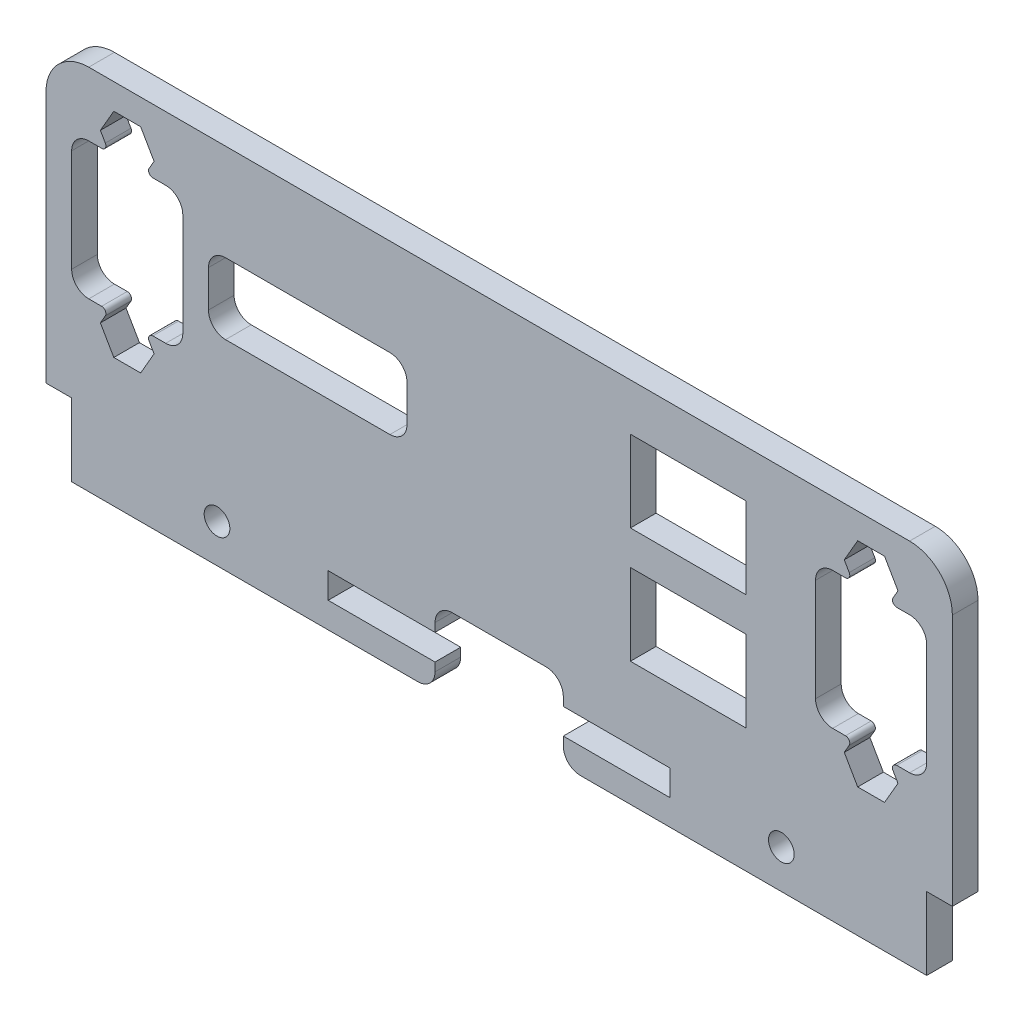
from build123d import *

# Parameters (mm, degrees)
ESBO_O1_W                  = 100
ESBO_O1_H                  = 43
RESSALTO_EXTRUS_O1_DEPTH   = 1.5
ESBO_O2_R                  = 1.5
CORTE_EXTRUS_O1_DEPTH      = 55.50917354
CUT_EXTRUDE6_DEPTH         = 55.447222151
CUT_EXTRUDE6_DEPTH_BACK    = 55.447222151
SKETCH7_W                  = 13.5
SKETCH7_H                  = 9.5
SKETCH8_W                  = 3
SKETCH8_H                  = 34.5
BOSS_EXTRUDE1_DEPTH        = 1.5
FILLET3_R                  = 2
FILLET4_R                  = 5
CORTE_GY_VL53L0_DEPTH      = 58.214508649
CORTE_GY_VL53L0_DEPTH_BACK = 58.214508649
CUT_EXTRUDE7_DEPTH         = 58.273466806
CUT_EXTRUDE7_DEPTH_BACK    = 58.273466806


with BuildPart() as part:
    # Esboço1 → Ressalto-extrusão1 (new, symmetric)
    with BuildSketch(Plane.XY):
        Rectangle(ESBO_O1_W, ESBO_O1_H)
    extrude(amount=RESSALTO_EXTRUS_O1_DEPTH, both=True)

    # Esboço2 → Corte-extrusão1 (cut, through all)
    with BuildSketch(Plane.XY.offset(1.5)):
        with Locations((-33, -17)):
            Circle(ESBO_O2_R)
        with Locations(Location((33, -17, 0), (0, 0, 180))):
            Circle(ESBO_O2_R)
        Polygon((-20, -15.5), (-7.5, -15.5), (-7.5, -12.5), (7.5, -12.5), (7.5, -15.5), (20, -15.5), (20, -18.5), (7.5, -18.5), (7.5, -21.5), (-7.5, -21.5), (-7.5, -18.5), (-20, -18.5), align=None)
    extrude(amount=-CORTE_EXTRUS_O1_DEPTH, mode=Mode.SUBTRACT)

    # Sketch7 → Cut-Extrude6 (cut, two sides: drawn at the far end of the back side and taken through both)
    with BuildSketch(Plane.XY.offset(-CUT_EXTRUDE6_DEPTH_BACK)):
        with Locations((22.1, -2.25)):
            Rectangle(SKETCH7_W, SKETCH7_H)
        with Locations((22.1, 11.25)):
            Rectangle(SKETCH7_W, SKETCH7_H)
    extrude(amount=CUT_EXTRUDE6_DEPTH + CUT_EXTRUDE6_DEPTH_BACK, mode=Mode.SUBTRACT)

    # Sketch8 → Boss-Extrude1 (add, symmetric)
    with BuildSketch(Plane.XY):
        with Locations((-51.5, 4.25)):
            Rectangle(SKETCH8_W, SKETCH8_H)
        with Locations((51.5, 4.25)):
            Rectangle(SKETCH8_W, SKETCH8_H)
    extrude(amount=BOSS_EXTRUDE1_DEPTH, both=True)

    # Fillet3
    fillet3_edges = [part.edges().sort_by_distance(p)[0] for p in [
        (-7.5, -21.5, 0),
        (-7.5, -12.5, 0),
        (7.5, -12.5, 0),
        (7.5, -21.5, 0),
    ]]
    fillet(fillet3_edges, radius=FILLET3_R)

    # Fillet4
    fillet4_edges = [part.edges().sort_by_distance(p)[0] for p in [
        (53, 21.5, 0),
        (-53, 21.5, 0),
    ]]
    fillet(fillet4_edges, radius=FILLET4_R)

    # Sketch6 → Corte Gy-VL53L0 (cut, two sides: drawn at the far end of the back side and taken through both)
    with BuildSketch(Plane.XY.offset(-CORTE_GY_VL53L0_DEPTH_BACK)):
        with BuildLine():
            Line((-40.5, 14.030680232), (-40.504337567, 14.030680232))
            ThreePointArc((-40.504337567, 14.030680232), (-40.937350269, 14.280680232), (-40.937350269, 14.780680232))
            Line((-40.937350269, 14.780680232), (-40.36, 15.780680232))
            Line((-40.36, 15.780680232), (-41.93, 18.5))
            Line((-41.93, 18.5), (-45.07, 18.5))
            Line((-45.07, 18.5), (-46.64, 15.780680232))
            Line((-46.64, 15.780680232), (-46.062649731, 14.780680232))
            ThreePointArc((-46.062649731, 14.780680232), (-46.062649731, 14.280680232), (-46.495662433, 14.030680232))
            Line((-46.495662433, 14.030680232), (-48, 14.030680232))
            ThreePointArc((-48, 14.030680232), (-49.414213562, 13.444893794), (-50, 12.030680232))
            Line((-50, 12.030680232), (-50, 0.030680232))
            ThreePointArc((-50, 0.030680232), (-49.414213562, -1.38353333), (-48, -1.969319768))
            Line((-48, -1.969319768), (-46.495662433, -1.969319768))
            ThreePointArc((-46.495662433, -1.969319768), (-46.062649731, -2.219319768), (-46.062649731, -2.719319768))
            Line((-46.062649731, -2.719319768), (-46.64, -3.719319768))
            Line((-46.64, -3.719319768), (-45.07, -6.438639536))
            Line((-45.07, -6.438639536), (-41.93, -6.438639536))
            Line((-41.93, -6.438639536), (-40.36, -3.719319768))
            Line((-40.36, -3.719319768), (-40.937350269, -2.719319768))
            ThreePointArc((-40.937350269, -2.719319768), (-40.937350269, -2.219319768), (-40.504337567, -1.969319768))
            Line((-40.504337567, -1.969319768), (-39, -1.969319768))
            ThreePointArc((-39, -1.969319768), (-37.585786438, -1.38353333), (-37, 0.030680232))
            Line((-37, 0.030680232), (-37, 6.030680232))
            Line((-37, 6.030680232), (-37, 12.030680232))
            ThreePointArc((-37, 12.030680232), (-37.585786438, 13.444893794), (-39, 14.030680232))
            Line((-39, 14.030680232), (-40.5, 14.030680232))
        make_face()
        with BuildLine():
            Line((40.5, 14.030680232), (40.504337567, 14.030680232))
            ThreePointArc((40.504337567, 14.030680232), (40.937350269, 14.280680232), (40.937350269, 14.780680232))
            Line((40.937350269, 14.780680232), (40.36, 15.780680232))
            Line((40.36, 15.780680232), (41.93, 18.5))
            Line((41.93, 18.5), (45.07, 18.5))
            Line((45.07, 18.5), (46.64, 15.780680232))
            Line((46.64, 15.780680232), (46.062649731, 14.780680232))
            ThreePointArc((46.062649731, 14.780680232), (46.062649731, 14.280680232), (46.495662433, 14.030680232))
            Line((46.495662433, 14.030680232), (48, 14.030680232))
            ThreePointArc((48, 14.030680232), (49.414213562, 13.444893794), (50, 12.030680232))
            Line((50, 12.030680232), (50, 0.030680232))
            ThreePointArc((50, 0.030680232), (49.414213562, -1.38353333), (48, -1.969319768))
            Line((48, -1.969319768), (46.495662433, -1.969319768))
            ThreePointArc((46.495662433, -1.969319768), (46.062649731, -2.219319768), (46.062649731, -2.719319768))
            Line((46.062649731, -2.719319768), (46.64, -3.719319768))
            Line((46.64, -3.719319768), (45.07, -6.438639536))
            Line((45.07, -6.438639536), (41.93, -6.438639536))
            Line((41.93, -6.438639536), (40.36, -3.719319768))
            Line((40.36, -3.719319768), (40.937350269, -2.719319768))
            ThreePointArc((40.937350269, -2.719319768), (40.937350269, -2.219319768), (40.504337567, -1.969319768))
            Line((40.504337567, -1.969319768), (39, -1.969319768))
            ThreePointArc((39, -1.969319768), (37.585786438, -1.38353333), (37, 0.030680232))
            Line((37, 0.030680232), (37, 6.030680232))
            Line((37, 6.030680232), (37, 12.030680232))
            ThreePointArc((37, 12.030680232), (37.585786438, 13.444893794), (39, 14.030680232))
            Line((39, 14.030680232), (40.5, 14.030680232))
        make_face()
    extrude(amount=CORTE_GY_VL53L0_DEPTH + CORTE_GY_VL53L0_DEPTH_BACK, mode=Mode.SUBTRACT)

    # Sketch11 → Cut-Extrude7 (cut, two sides: drawn at the far end of the back side and taken through both)
    with BuildSketch(Plane.XY.offset(1.5).offset(-CUT_EXTRUDE7_DEPTH_BACK)):
        with BuildLine():
            Line((-32, 10.2), (-12.78, 10.2))
            ThreePointArc((-12.78, 10.2), (-11.365786438, 9.614213562), (-10.78, 8.2))
            Line((-10.78, 8.2), (-10.78, 3.9))
            ThreePointArc((-10.78, 3.9), (-11.365786438, 2.485786438), (-12.78, 1.9))
            Line((-12.78, 1.9), (-32, 1.9))
            ThreePointArc((-32, 1.9), (-33.414213562, 2.485786438), (-34, 3.9))
            Line((-34, 3.9), (-34, 8.2))
            ThreePointArc((-34, 8.2), (-33.414213562, 9.614213562), (-32, 10.2))
        make_face()
    extrude(amount=CUT_EXTRUDE7_DEPTH + CUT_EXTRUDE7_DEPTH_BACK, mode=Mode.SUBTRACT)


solid = part.part
